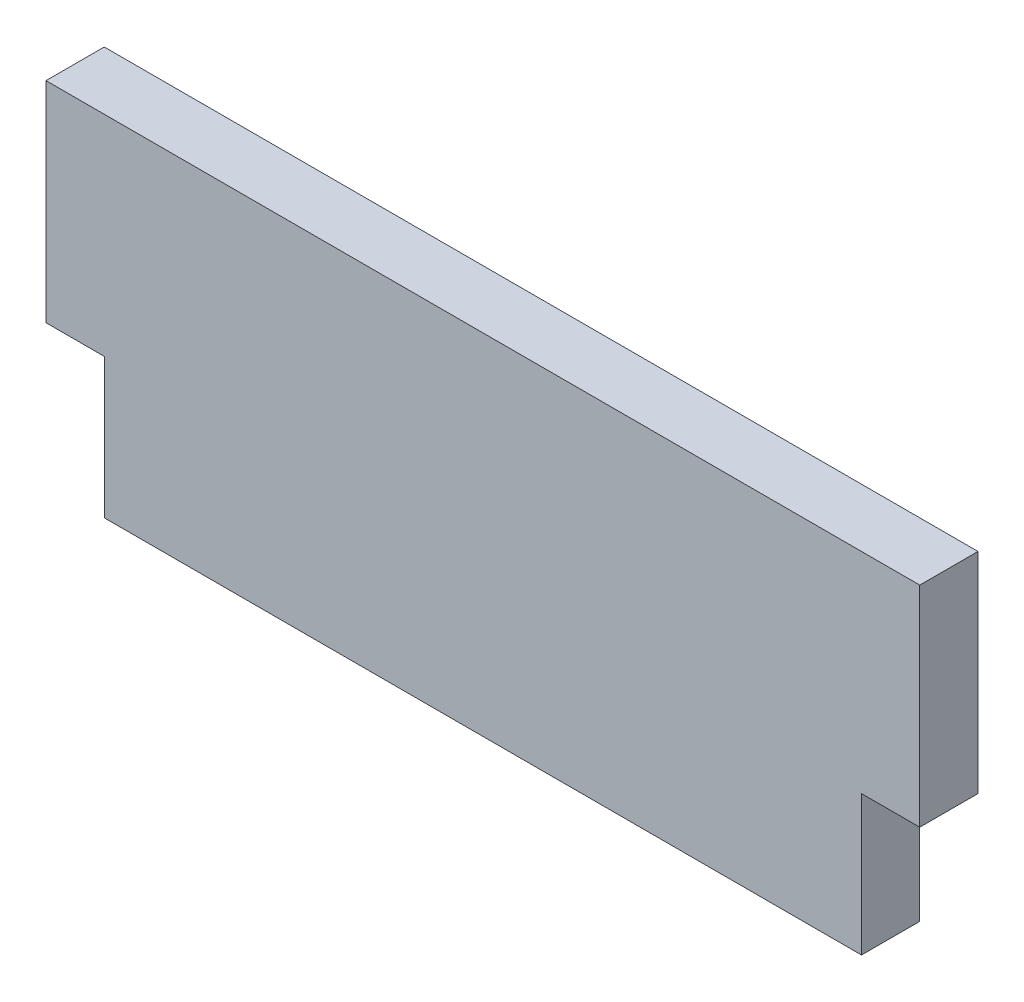
from build123d import *

# Parameters (mm, degrees)
SKIZZE1_W                       = 75
SKIZZE1_H                       = 30
AUFSATZ_LINEAR_AUSTRAGEN1_DEPTH = 5
SKIZZE2_W                       = 5
SKIZZE2_H                       = 12
SCHNITT_LINEAR_AUSTRAGEN1_DEPTH = 81.932070281


with BuildPart() as part:
    # Skizze1 → Aufsatz-Linear austragen1 (new body)
    with BuildSketch(Plane.XY):
        with Locations((37.5, 15)):
            Rectangle(SKIZZE1_W, SKIZZE1_H)
    extrude(amount=AUFSATZ_LINEAR_AUSTRAGEN1_DEPTH)

    # Skizze2 → Schnitt-Linear austragen1 (cut, through all)
    with BuildSketch(Plane.XY.offset(5)):
        with Locations((2.5, 6)):
            Rectangle(SKIZZE2_W, SKIZZE2_H)
        with Locations((72.5, 6)):
            Rectangle(SKIZZE2_W, SKIZZE2_H)
    extrude(amount=-SCHNITT_LINEAR_AUSTRAGEN1_DEPTH, mode=Mode.SUBTRACT)


solid = part.part
